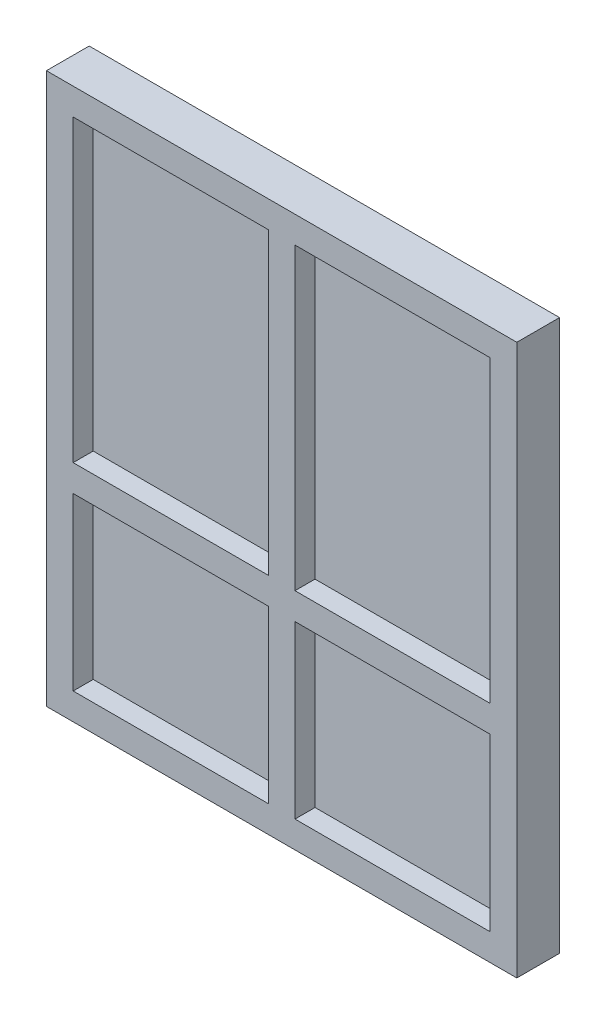
from build123d import *

# Parameters (mm, degrees)
SKETCH_1_W      = 1760
SKETCH_1_H      = 2060
SKETCH_1_W_2    = 730
SKETCH_1_H_2    = 1120
SKETCH_1_H_3    = 640
EXTRUDE_1_DEPTH = 80
SKETCH_2_W      = 1560
SKETCH_2_H      = 1860
EXTRUDE_2_DEPTH = 5


with BuildPart() as part:
    # Эскиз1 → Бобышка-Вытянуть1 (new, symmetric)
    with BuildSketch(Plane.XY):
        with Locations((880, 1030)):
            Rectangle(SKETCH_1_W, SKETCH_1_H)
        with Locations((465, 1400)):
            Rectangle(SKETCH_1_W_2, SKETCH_1_H_2, mode=Mode.SUBTRACT)
        with Locations((465, 420)):
            Rectangle(SKETCH_1_W_2, SKETCH_1_H_3, mode=Mode.SUBTRACT)
        with Locations((1295, 1400)):
            Rectangle(SKETCH_1_W_2, SKETCH_1_H_2, mode=Mode.SUBTRACT)
        with Locations((1295, 420)):
            Rectangle(SKETCH_1_W_2, SKETCH_1_H_3, mode=Mode.SUBTRACT)
    extrude(amount=EXTRUDE_1_DEPTH, both=True)


with BuildPart() as body_2:
    # Эскиз2 → Бобышка-Вытянуть2 (new, symmetric)
    with BuildSketch(Plane.XY):
        with Locations((880, 1030)):
            Rectangle(SKETCH_2_W, SKETCH_2_H)
    extrude(amount=EXTRUDE_2_DEPTH, both=True)


solid = Compound([part.part, body_2.part])
